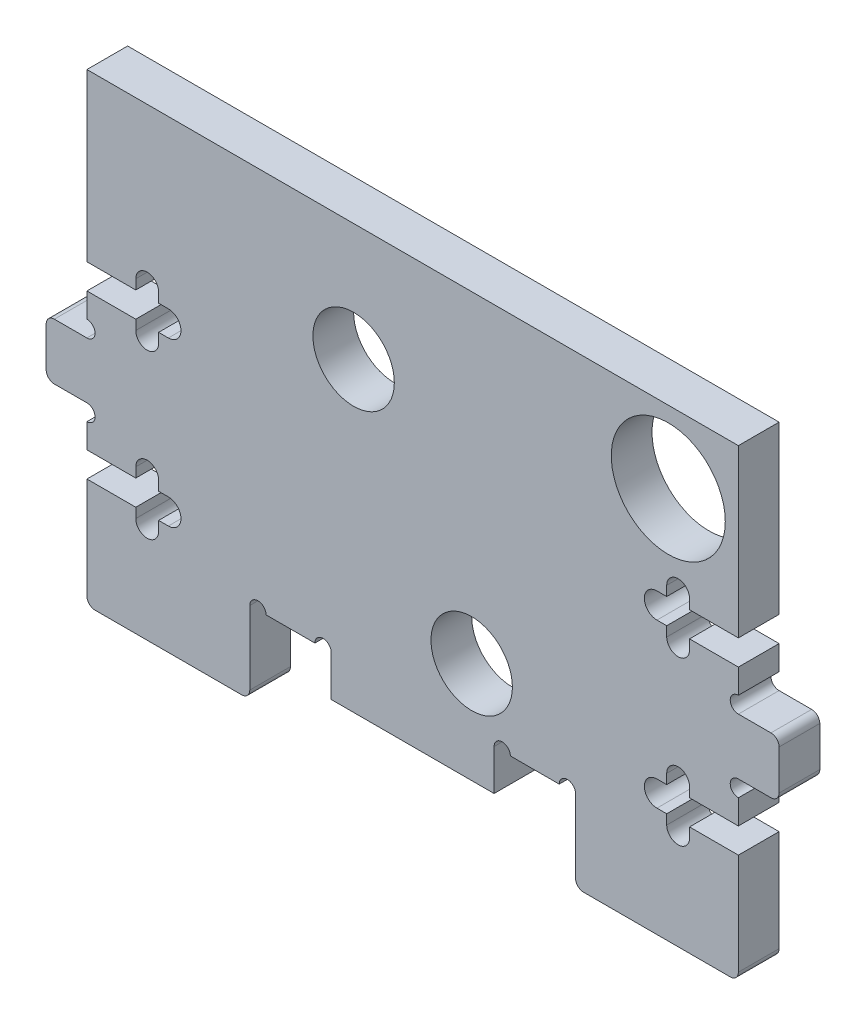
from build123d import *

# Parameters (mm, degrees)
SKETCH_1_W          = 80
SKETCH_1_H          = 52
EXTRUDE_1_DEPTH     = 5
SKETCH_2_R          = 7
CUT_EXTRUDE_1_DEPTH = 5
CUT_EXTRUDE_3_DEPTH = 10
SKETCH_7_R          = 5
CUT_EXTRUDE_4_DEPTH = 10
SKETCH_10_W         = 10
SKETCH_10_H         = 5
CUT_EXTRUDE_5_DEPTH = 10
SKETCH_11_R         = 1
CUT_EXTRUDE_6_DEPTH = 10
SKETCH_12_W         = 5
SKETCH_12_H         = 6.9
EXTRUDE_3_DEPTH     = 5
SKETCH_13_R         = 1
CUT_EXTRUDE_7_DEPTH = 5
FILLET_1_R          = 1
SKETCH_14_W         = 20
SKETCH_14_H         = 5
EXTRUDE_4_DEPTH     = 5
FILLET_2_R          = 1


with BuildPart() as part:
    # 스케치1 → 보스-돌출1 (new body)
    with BuildSketch(Plane.XY):
        with Locations((40, 26)):
            Rectangle(SKETCH_1_W, SKETCH_1_H)
    extrude(amount=EXTRUDE_1_DEPTH)

    # 스케치2 → 컷-돌출1 (cut)
    with BuildSketch(Plane.XY.offset(5)):
        with Locations((71.393420887, 43.125)):
            Circle(SKETCH_2_R)
    extrude(amount=-CUT_EXTRUDE_1_DEPTH, mode=Mode.SUBTRACT)

    # 스케치6 → 컷-돌출3 (cut)
    with BuildSketch(Plane.XY.offset(5)):
        with BuildLine():
            Line((0, 31.55), (6, 31.55))
            Line((6, 31.55), (6, 32.75))
            ThreePointArc((6, 32.75), (7.4, 34.15), (8.8, 32.75))
            Line((8.8, 32.75), (8.8, 31.55))
            Line((8.8, 31.55), (10, 31.55))
            ThreePointArc((10, 31.55), (11.55, 30), (10, 28.45))
            Line((10, 28.45), (8.8, 28.45))
            Line((8.8, 28.45), (8.8, 27.25))
            ThreePointArc((8.8, 27.25), (7.4, 25.85), (6, 27.25))
            Line((6, 27.25), (6, 28.45))
            Line((6, 28.45), (0, 28.45))
            Line((0, 28.45), (0, 31.55))
        make_face()
        with BuildLine():
            Line((0, 11.55), (6, 11.55))
            Line((6, 11.55), (6, 12.75))
            ThreePointArc((6, 12.75), (7.4, 14.15), (8.8, 12.75))
            Line((8.8, 12.75), (8.8, 11.55))
            Line((8.8, 11.55), (10, 11.55))
            ThreePointArc((10, 11.55), (11.55, 10), (10, 8.45))
            Line((10, 8.45), (8.8, 8.45))
            Line((8.8, 8.45), (8.8, 7.25))
            ThreePointArc((8.8, 7.25), (7.4, 5.85), (6, 7.25))
            Line((6, 7.25), (6, 8.45))
            Line((6, 8.45), (0, 8.45))
            Line((0, 8.45), (0, 11.55))
        make_face()
        with BuildLine():
            Line((74, 7.25), (74, 8.45))
            Line((74, 8.45), (80, 8.45))
            Line((80, 8.45), (80, 11.55))
            Line((80, 11.55), (74, 11.55))
            Line((74, 11.55), (74, 12.75))
            ThreePointArc((74, 12.75), (72.6, 14.15), (71.2, 12.75))
            Line((71.2, 12.75), (71.2, 11.55))
            Line((71.2, 11.55), (70, 11.55))
            ThreePointArc((70, 11.55), (68.45, 10), (70, 8.45))
            Line((70, 8.45), (71.2, 8.45))
            Line((71.2, 8.45), (71.2, 7.25))
            ThreePointArc((71.2, 7.25), (72.6, 5.85), (74, 7.25))
        make_face()
        with BuildLine():
            Line((74, 27.25), (74, 28.45))
            Line((74, 28.45), (80, 28.45))
            Line((80, 28.45), (80, 31.55))
            Line((80, 31.55), (74, 31.55))
            Line((74, 31.55), (74, 32.75))
            ThreePointArc((74, 32.75), (72.6, 34.15), (71.2, 32.75))
            Line((71.2, 32.75), (71.2, 31.55))
            Line((71.2, 31.55), (70, 31.55))
            ThreePointArc((70, 31.55), (68.45, 30), (70, 28.45))
            Line((70, 28.45), (71.2, 28.45))
            Line((71.2, 28.45), (71.2, 27.25))
            ThreePointArc((71.2, 27.25), (72.6, 25.85), (74, 27.25))
        make_face()
    extrude(amount=-CUT_EXTRUDE_3_DEPTH, mode=Mode.SUBTRACT)

    # 스케치7 → 컷-돌출4 (cut)
    with BuildSketch(Plane.XY.offset(5)):
        with Locations((32.75, 37.557368355)):
            Circle(SKETCH_7_R)
        with Locations((47.25, 12.442631645)):
            Circle(SKETCH_7_R)
    extrude(amount=-CUT_EXTRUDE_4_DEPTH, mode=Mode.SUBTRACT)

    # 스케치10 → 컷-돌출5 (cut)
    with BuildSketch(Plane(origin=(0, 0, 0), x_dir=(-1, 0, 0), z_dir=(0, 0, -1))):
        with Locations((-25, 2.5)):
            Rectangle(SKETCH_10_W, SKETCH_10_H)
        with Locations((-55, 2.5)):
            Rectangle(SKETCH_10_W, SKETCH_10_H)
    extrude(amount=-CUT_EXTRUDE_5_DEPTH, mode=Mode.SUBTRACT)

    # 스케치11 → 컷-돌출6 (cut)
    with BuildSketch(Plane.XY.offset(5)):
        with Locations((59, 5)):
            Circle(SKETCH_11_R)
        with Locations((51, 5)):
            Circle(SKETCH_11_R)
        with Locations((29, 5)):
            Circle(SKETCH_11_R)
        with Locations((21, 5)):
            Circle(SKETCH_11_R)
    extrude(amount=-CUT_EXTRUDE_6_DEPTH, mode=Mode.SUBTRACT)

    # 스케치12 → 보스-돌출3 (add)
    with BuildSketch(Plane.XY.offset(5)):
        with Locations((82.5, 20)):
            Rectangle(SKETCH_12_W, SKETCH_12_H)
        with Locations((-2.5, 20)):
            Rectangle(SKETCH_12_W, SKETCH_12_H)
    extrude(amount=-EXTRUDE_3_DEPTH)

    # 스케치13 → 컷-돌출7 (cut)
    with BuildSketch(Plane.XY.offset(5)):
        with Locations((80, 24.45)):
            Circle(SKETCH_13_R)
        with Locations((80, 15.55)):
            Circle(SKETCH_13_R)
        with Locations((0, 15.55)):
            Circle(SKETCH_13_R)
        with Locations((0, 24.45)):
            Circle(SKETCH_13_R)
    extrude(amount=-CUT_EXTRUDE_7_DEPTH, mode=Mode.SUBTRACT)

    # 필렛1
    fillet_1_edges = [part.edges().sort_by_distance(p)[0] for p in [
        (85, 23.45, 2.5),
        (85, 16.55, 2.5),
        (-5, 16.55, 2.5),
        (-5, 23.45, 2.5),
    ]]
    fillet(fillet_1_edges, radius=FILLET_1_R)

    # 스케치14 → 보스-돌출4 (add)
    with BuildSketch(Plane.XY.offset(5)):
        with Locations((70, -2.5)):
            Rectangle(SKETCH_14_W, SKETCH_14_H)
        with Locations((10, -2.5)):
            Rectangle(SKETCH_14_W, SKETCH_14_H)
    extrude(amount=-EXTRUDE_4_DEPTH)

    # 필렛2
    fillet_2_edges = [part.edges().sort_by_distance(p)[0] for p in [
        (80, -5, 2.5),
        (60, -5, 2.5),
        (0, -5, 2.5),
        (20, -5, 2.5),
    ]]
    fillet(fillet_2_edges, radius=FILLET_2_R)


solid = part.part
